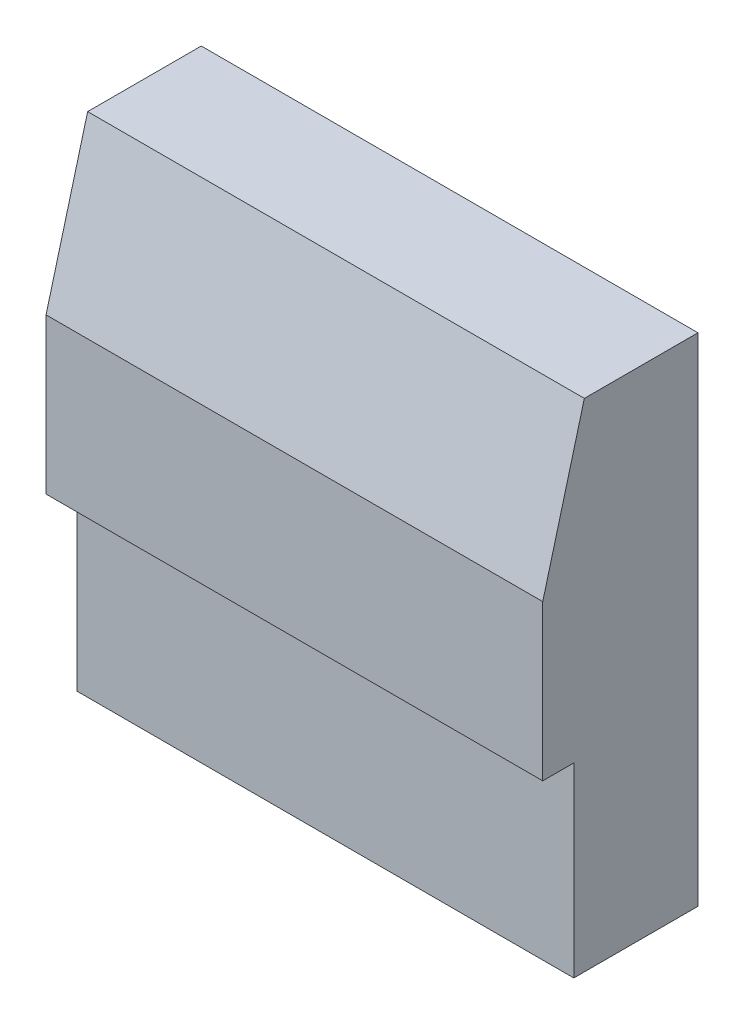
from build123d import *

# Parameters (mm, degrees)
SALIENTE_EXTRUIR1_DEPTH      = 16
SALIENTE_EXTRUIR1_DEPTH_BACK = 16


with BuildPart() as part:
    # Croquis1 → Saliente-Extruir1 (new, two sides: drawn at the far end of the back side and taken through both)
    with BuildSketch(Plane(origin=(0, 0, 0), x_dir=(0, 0, -1), z_dir=(1, 0, 0)).offset(-SALIENTE_EXTRUIR1_DEPTH_BACK)):
        Polygon((0, 0), (0, 32), (-7.320508076, 32), (-10, 22), (-10, 12), (-8, 12), (-8, 0), align=None)
    extrude(amount=SALIENTE_EXTRUIR1_DEPTH + SALIENTE_EXTRUIR1_DEPTH_BACK)


solid = part.part
